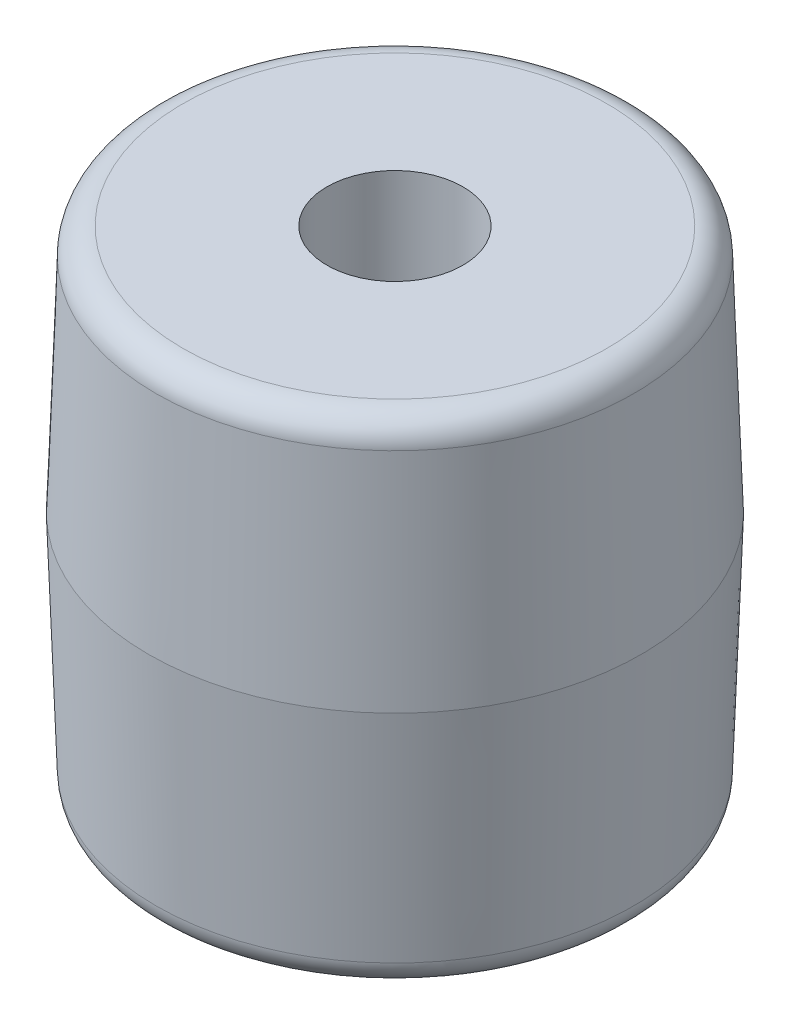
from build123d import *

# Parameters (mm, degrees)
SKETCH1_R           = 9.2075
BOSS_EXTRUDE1_DEPTH = 9.25
BOSS_EXTRUDE1_TAPER = 2
SKETCH2_R           = 2.54
CUT_EXTRUDE1_DEPTH  = 23.623132407
FILLET1_R           = 1


with BuildPart() as part:
    # Sketch1 → Boss-Extrude1 (new body)
    with BuildSketch(Plane(origin=(0, 0, 0), x_dir=(1, 0, 0), z_dir=(0, 1, 0))):
        Circle(SKETCH1_R)
    boss_extrude1 = extrude(amount=BOSS_EXTRUDE1_DEPTH, taper=BOSS_EXTRUDE1_TAPER)

    # Mirror1: Boss-Extrude1 across plane
    add(boss_extrude1.mirror(Plane.ZX))

    # Sketch2 → Cut-Extrude1 (cut, through all)
    with BuildSketch(Plane(origin=(0, -9.25, 0), x_dir=(-1, 0, 0), z_dir=(0, -1, 0))):
        with Locations(Location((0, 0, 0), (0, 0, 90))):
            Circle(SKETCH2_R)
    extrude(amount=-CUT_EXTRUDE1_DEPTH, mode=Mode.SUBTRACT)

    # Fillet1
    fillet1_edges = [part.edges().sort_by_distance(p)[0] for p in [
        (-8.884482882, 9.25, 0),
        (-8.884482882, -9.25, 0),
    ]]
    fillet(fillet1_edges, radius=FILLET1_R)


solid = part.part
